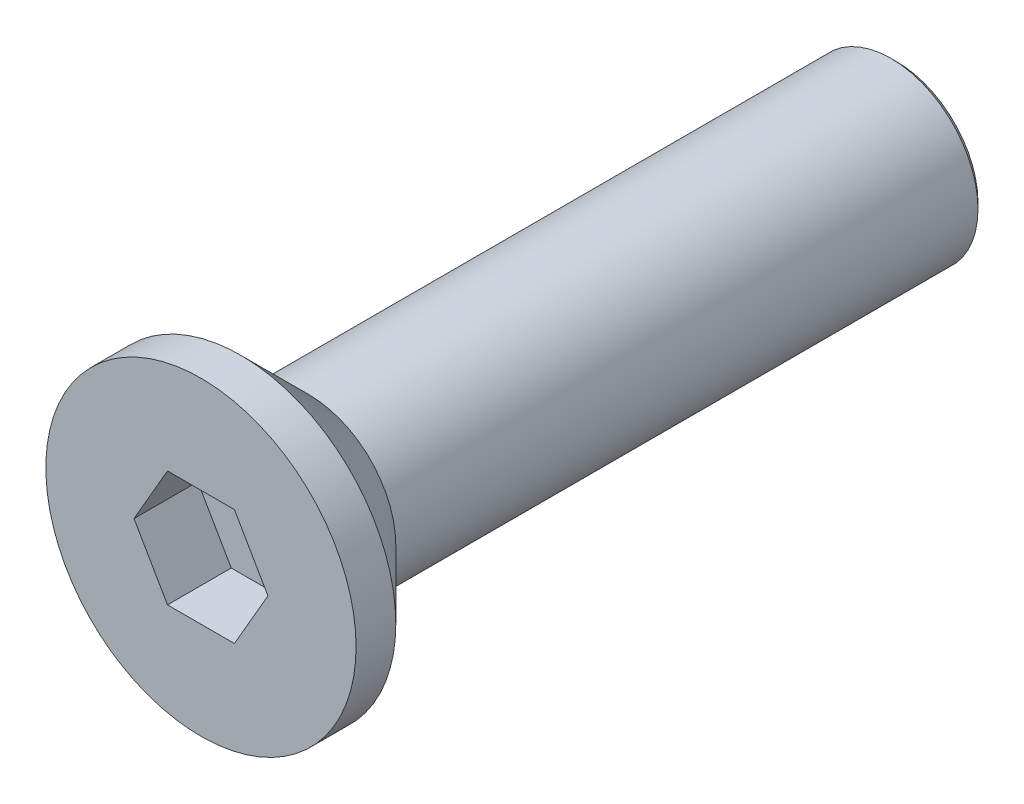
from build123d import *

# Parameters (mm, degrees)
HEX_CUT_DEPTH = 1.1


with BuildPart() as part:
    # Body_Sketch → Body_Revolve (revolve)
    with BuildSketch(Plane(origin=(0, 0, 0), x_dir=(0, 0, -1), z_dir=(1, 0, 0))):
        Polygon((0, 1.5), (10.04, 1.5), (10.14, 1.4), (10.14, 0), (-1.86, 0), (-1.86, 2.675), (-1.175, 2.675), align=None)
    revolve(axis=Axis((0, 0, 0), (0, 0, -1)))

    # Key_Sketch → Hex_Cut (cut)
    with BuildSketch(Plane.XY.offset(1.86)):
        Polygon((1.154700538, 0), (0.577350269, 1), (-0.577350269, 1), (-1.154700538, 0), (-0.577350269, -1), (0.577350269, -1), align=None)
    extrude(amount=-HEX_CUT_DEPTH, mode=Mode.SUBTRACT)


solid = part.part
